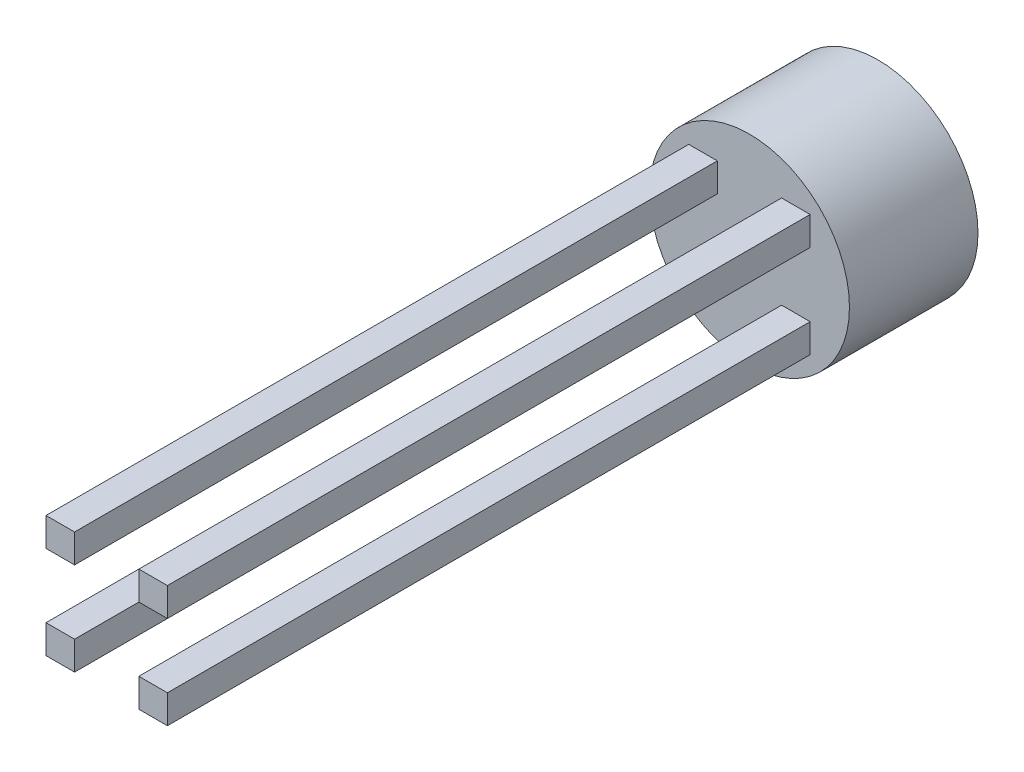
from build123d import *

# Parameters (mm, degrees)
SKETCH_1_R          = 7
EXTRUDE_1_DEPTH     = 9
SKETCH_2_W          = 2
SKETCH_2_H          = 2
EXTRUDE_2_DEPTH     = 45
CUT_EXTRUDE_1_DEPTH = 4
SKETCH_5_W          = 2
SKETCH_5_H          = 2
EXTRUDE_3_DEPTH     = 4


with BuildPart() as part:
    # 草图1 → 凸台-拉伸1 (new body)
    with BuildSketch(Plane.XY):
        Circle(SKETCH_1_R)
    extrude(amount=EXTRUDE_1_DEPTH)

    # 草图2 → 凸台-拉伸2 (add)
    with BuildSketch(Plane.XY.offset(9)):
        with Locations((3.25, 3.25)):
            Rectangle(SKETCH_2_W, SKETCH_2_H)
        with Locations((-3.25, 3.25)):
            Rectangle(SKETCH_2_W, SKETCH_2_H)
        with Locations((3.25, -3.25)):
            Rectangle(SKETCH_2_W, SKETCH_2_H)
        with Locations((-3.25, -3.25)):
            Rectangle(SKETCH_2_W, SKETCH_2_H)
    extrude(amount=EXTRUDE_2_DEPTH)

    # 草图4 → 切除-拉伸1 (cut)
    with BuildSketch(Plane(origin=(0, 0, 0), x_dir=(-1, 0, 0), z_dir=(0, 0, -1))):
        Polygon((-2.500889242, 1.671040767), (-2.95, 1.221930009), (-2.95, 0.586791484), (-3.193056991, 0), (-2.95, -0.586791484), (-2.95, -1.221930009), (-2.500889242, -1.671040767), (-2.257832251, -2.257832251), (-1.671040767, -2.500889242), (-1.221930009, -2.95), (-0.586791484, -2.95), (0, -3.193056991), (0.586791484, -2.95), (1.221930009, -2.95), (1.671040767, -2.500889242), (2.257832251, -2.257832251), (2.500889242, -1.671040767), (2.95, -1.221930009), (2.95, -0.586791484), (3.193056991, 0), (2.95, 0.586791484), (2.95, 1.221930009), (2.500889242, 1.671040767), (2.257832251, 2.257832251), (1.671040767, 2.500889242), (1.221930009, 2.95), (0.586791484, 2.95), (0, 3.193056991), (-0.586791484, 2.95), (-1.221930009, 2.95), (-1.671040767, 2.500889242), (-2.257832251, 2.257832251), align=None)
    extrude(amount=-CUT_EXTRUDE_1_DEPTH, mode=Mode.SUBTRACT)

    # 草图5 → 凸台-拉伸3 (add)
    with BuildSketch(Plane(origin=(0, 0, 4), x_dir=(-1, 0, 0), z_dir=(0, 0, -1))):
        Rectangle(SKETCH_5_W, SKETCH_5_H)
    extrude(amount=EXTRUDE_3_DEPTH)


solid = part.part
